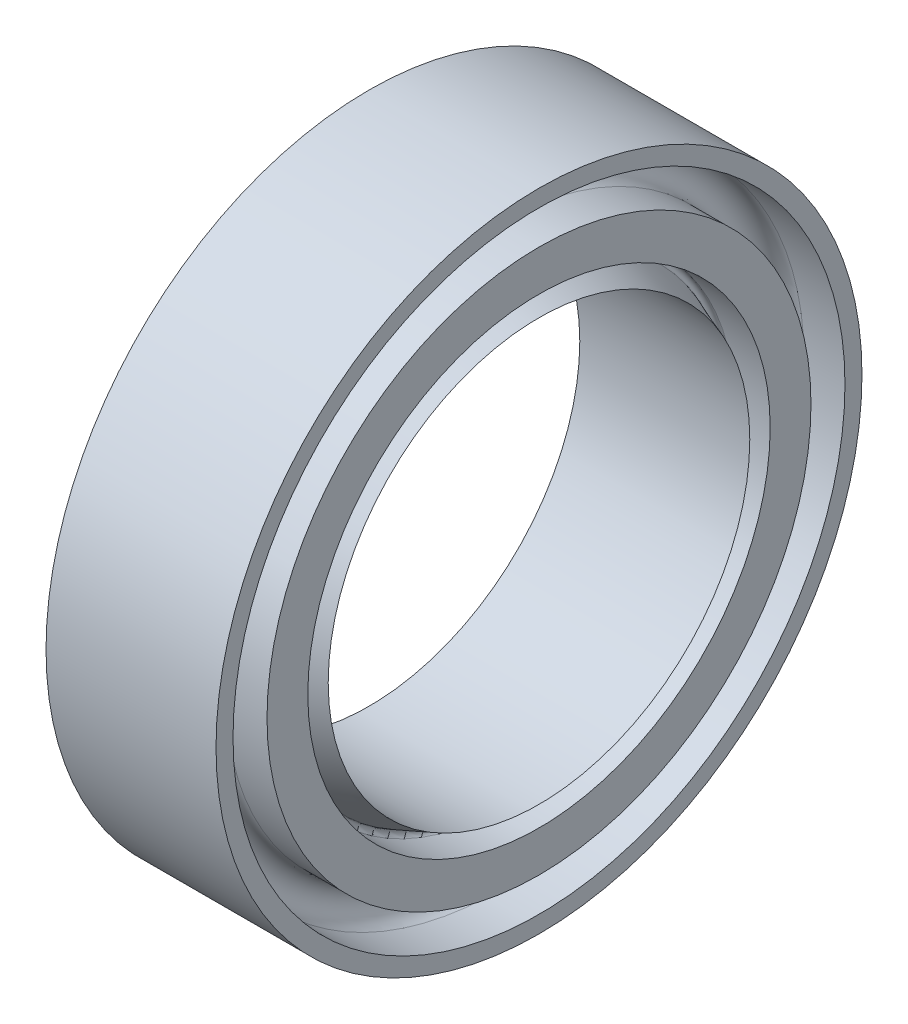
from build123d import *


with BuildPart() as part:
    # Esquisse1 → corps (revolve)
    with BuildSketch(Plane.XY, mode=Mode.PRIVATE) as corps_sk:
        with BuildLine():
            Line((0, 31), (25, 31))
            Line((25, 31), (19.581772237, 33.031835411))
            ThreePointArc((19.581772237, 33.031835411), (19.265357182, 33.589212403), (19.757333958, 34))
            Line((19.757333958, 34), (25, 34))
            Line((25, 34), (25, 40))
            Line((25, 40), (19, 40))
            ThreePointArc((19, 40), (16.5, 42.5), (19, 45))
            Line((19, 45), (25, 45))
            Line((25, 45), (25, 47.5))
            Line((25, 47.5), (0, 47.5))
            Line((0, 47.5), (0, 45))
            Line((0, 45), (6, 45))
            ThreePointArc((6, 45), (8.5, 42.5), (6, 40))
            Line((6, 40), (0, 40))
            Line((0, 40), (0, 34))
            Line((0, 34), (5.242666042, 34))
            ThreePointArc((5.242666042, 34), (5.734642818, 33.589212403), (5.418227763, 33.031835411))
            Line((5.418227763, 33.031835411), (0, 31))
        make_face()
    revolve(corps_sk.sketch.rotate(Axis((0, 0, 0), (1, 0, 0)), 90), axis=Axis((0, 0, 0), (1, 0, 0)))


solid = part.part
